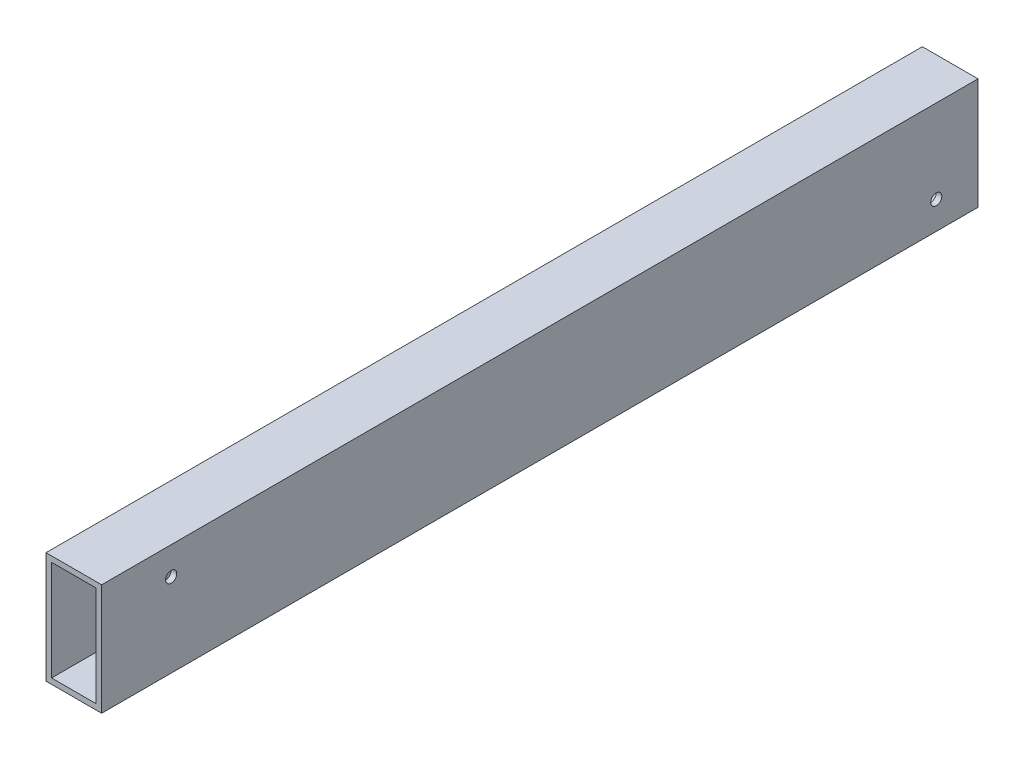
from build123d import *

# Parameters (mm, degrees)
SKETCH_1_W          = 20
SKETCH_1_H          = 40
SKETCH_1_W_2        = 16
SKETCH_1_H_2        = 36
EXTRUDE_1_DEPTH     = 315
SKETCH_2_R          = 2
CUT_EXTRUDE_1_DEPTH = 319.158765399
SKETCH_3_R          = 1.75
CUT_EXTRUDE_2_DEPTH = 2
SKETCH_4_R          = 1.75
CUT_EXTRUDE_3_DEPTH = 2


with BuildPart() as part:
    # 草图1 → 凸台-拉伸1 (new body)
    with BuildSketch(Plane.XY):
        with Locations((10, 20)):
            Rectangle(SKETCH_1_W, SKETCH_1_H)
        with Locations((10, 20)):
            Rectangle(SKETCH_1_W_2, SKETCH_1_H_2, mode=Mode.SUBTRACT)
    extrude(amount=EXTRUDE_1_DEPTH)

    # 草图2 → 切除-拉伸1 (cut, through all)
    with BuildSketch(Plane(origin=(20, 0, 0), x_dir=(0, 0, -1), z_dir=(1, 0, 0))):
        with Locations((-290, 30)):
            Circle(SKETCH_2_R)
        with Locations((-15, 10)):
            Circle(SKETCH_2_R)
    extrude(amount=-CUT_EXTRUDE_1_DEPTH, mode=Mode.SUBTRACT)

    # 草图3 → 切除-拉伸2 (cut)
    with BuildSketch(Plane.ZY):
        with Locations((10, 17.65)):
            Circle(SKETCH_3_R)
        with Locations((30, 17.65)):
            Circle(SKETCH_3_R)
        with Locations((50, 17.65)):
            Circle(SKETCH_3_R)
        with Locations((70, 17.65)):
            Circle(SKETCH_3_R)
        with Locations((90, 17.65)):
            Circle(SKETCH_3_R)
        with Locations((110, 17.65)):
            Circle(SKETCH_3_R)
        with Locations((130, 17.65)):
            Circle(SKETCH_3_R)
        with Locations((150, 17.65)):
            Circle(SKETCH_3_R)
        with Locations((170, 17.65)):
            Circle(SKETCH_3_R)
        with Locations((190, 17.65)):
            Circle(SKETCH_3_R)
        with Locations((210, 17.65)):
            Circle(SKETCH_3_R)
        with Locations((230, 17.65)):
            Circle(SKETCH_3_R)
        with Locations((250, 17.65)):
            Circle(SKETCH_3_R)
        with Locations((270, 17.65)):
            Circle(SKETCH_3_R)
    extrude(amount=-CUT_EXTRUDE_2_DEPTH, mode=Mode.SUBTRACT)

    # 草图4 → 切除-拉伸3 (cut)
    with BuildSketch(Plane(origin=(0, 0, 0), x_dir=(-1, 0, 0), z_dir=(0, -1, 0))):
        with Locations(Location((-10, -10, 0), (0, 0, 90))):
            Circle(SKETCH_4_R)
        with Locations(Location((-10, -30, 0), (0, 0, 90))):
            Circle(SKETCH_4_R)
        with Locations(Location((-10, -50, 0), (0, 0, 90))):
            Circle(SKETCH_4_R)
        with Locations(Location((-10, -70, 0), (0, 0, 90))):
            Circle(SKETCH_4_R)
        with Locations(Location((-10, -90, 0), (0, 0, 90))):
            Circle(SKETCH_4_R)
        with Locations(Location((-10, -110, 0), (0, 0, 90))):
            Circle(SKETCH_4_R)
        with Locations(Location((-10, -130, 0), (0, 0, 90))):
            Circle(SKETCH_4_R)
        with Locations(Location((-10, -150, 0), (0, 0, 90))):
            Circle(SKETCH_4_R)
        with Locations(Location((-10, -170, 0), (0, 0, 90))):
            Circle(SKETCH_4_R)
        with Locations(Location((-10, -190, 0), (0, 0, 90))):
            Circle(SKETCH_4_R)
        with Locations(Location((-10, -210, 0), (0, 0, 90))):
            Circle(SKETCH_4_R)
        with Locations(Location((-10, -230, 0), (0, 0, 90))):
            Circle(SKETCH_4_R)
        with Locations(Location((-10, -250, 0), (0, 0, 90))):
            Circle(SKETCH_4_R)
        with Locations(Location((-10, -270, 0), (0, 0, 90))):
            Circle(SKETCH_4_R)
    extrude(amount=-CUT_EXTRUDE_3_DEPTH, mode=Mode.SUBTRACT)


solid = part.part
